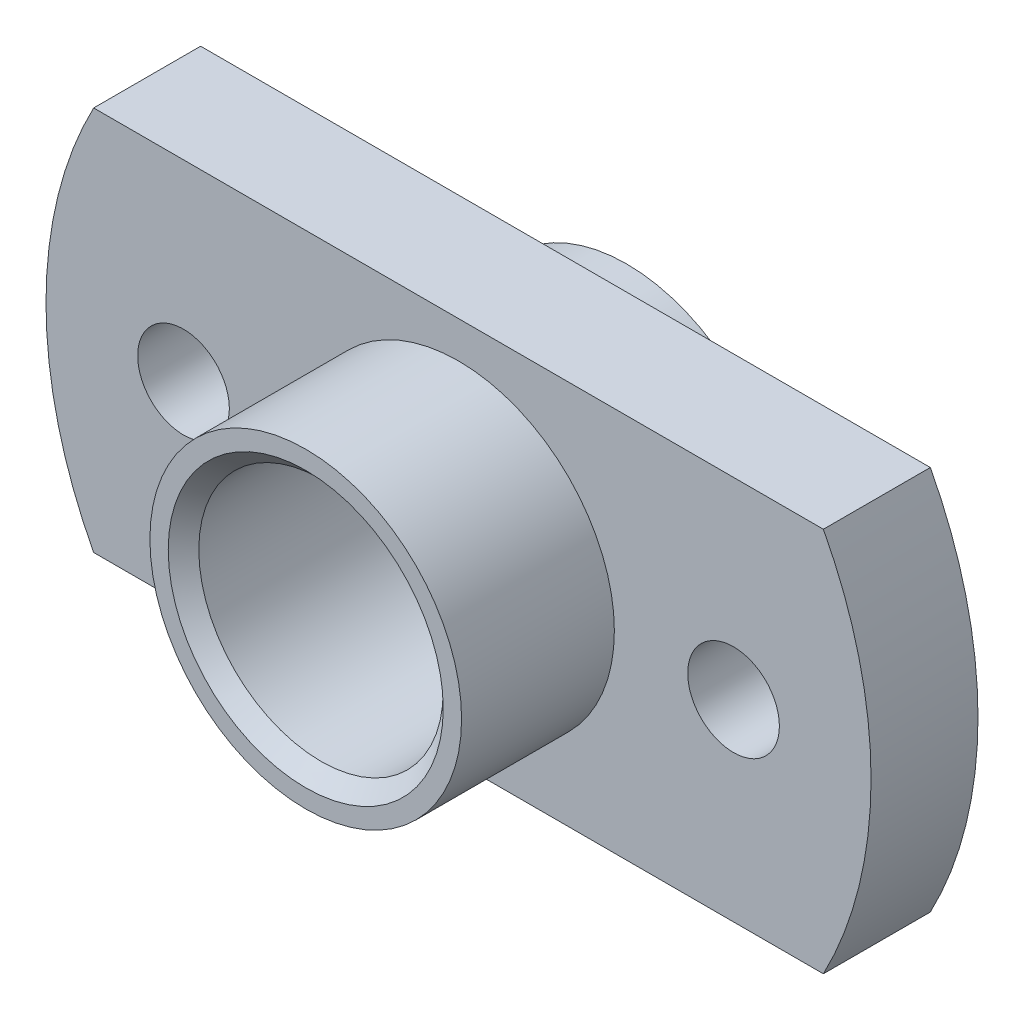
from build123d import *

# Parameters (mm, degrees)
SKICA1_R                     = 1.5
P_IDAT_VYSUNUT_M1_DEPTH      = 3.5
P_IDAT_VYSUNUT_M2_DEPTH      = 5
P_IDAT_VYSUNUT_M2_DEPTH_BACK = 5.5
SKICA2_R                     = 5.1
SKICA3_R                     = 4
ODEBRAT_VYSUNUT_M1_DEPTH     = 10.5
ZKOSEN_1_SIZE                = 0.5


with BuildPart() as part:
    # Skica1 → Přidat vysunutím1 (new body)
    with BuildSketch(Plane.XY):
        with BuildLine():
            Line((-11.939849245, 6.3), (11.939849245, 6.3))
            ThreePointArc((11.939849245, 6.3), (13.5, 0), (11.939849245, -6.3))
            Line((11.939849245, -6.3), (-11.939849245, -6.3))
            ThreePointArc((-11.939849245, -6.3), (-13.5, 0), (-11.939849245, 6.3))
        make_face()
        with Locations((-9, 0)):
            Circle(SKICA1_R, mode=Mode.SUBTRACT)
        with Locations((9, 0)):
            Circle(SKICA1_R, mode=Mode.SUBTRACT)
    extrude(amount=P_IDAT_VYSUNUT_M1_DEPTH)

    # Skica2 → Přidat vysunutím2 (add, two sides: drawn at the far end of the back side and taken through both)
    with BuildSketch(Plane.XY.offset(3.5).offset(-P_IDAT_VYSUNUT_M2_DEPTH_BACK)):
        Circle(SKICA2_R)
    extrude(amount=P_IDAT_VYSUNUT_M2_DEPTH + P_IDAT_VYSUNUT_M2_DEPTH_BACK)

    # Skica3 → Odebrat vysunutím1 (cut)
    with BuildSketch(Plane.XY.offset(8.5)):
        Circle(SKICA3_R)
    extrude(amount=-ODEBRAT_VYSUNUT_M1_DEPTH, mode=Mode.SUBTRACT)

    # Zkosení1
    zkosen_1_edges = [part.edges().sort_by_distance(p)[0] for p in [
        (-4, 0, 8.5),
        (-4, 0, -2),
    ]]
    chamfer(zkosen_1_edges, length=ZKOSEN_1_SIZE)


solid = part.part
